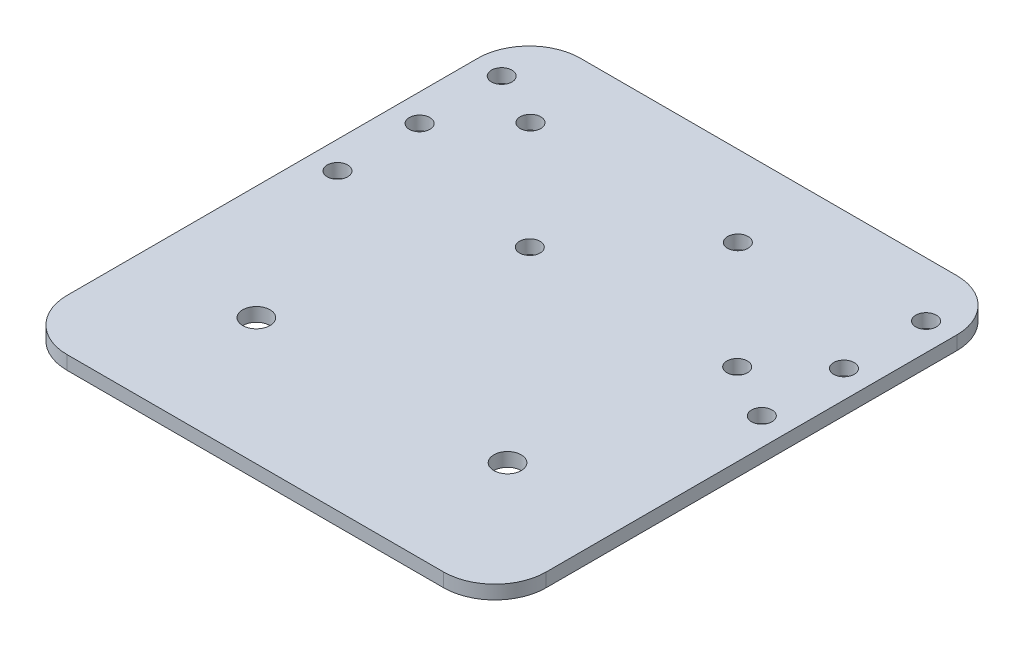
from build123d import *

# Parameters (mm, degrees)
SKETCH1_W           = 70
SKETCH1_H           = 75
SKETCH1_R           = 1.5
SKETCH1_R_2         = 2
BOSS_EXTRUDE1_DEPTH = 2
FILLET2_R           = 7.5


with BuildPart() as part:
    # Sketch1 → Boss-Extrude1 (new body)
    with BuildSketch(Plane(origin=(0, 0, 0), x_dir=(1, 0, 0), z_dir=(0, 1, 0))):
        with Locations((0, -1)):
            Rectangle(SKETCH1_W, SKETCH1_H)
        with Locations(Location((7.3, 24.7, 0), (0, 0, 270))):
            Circle(SKETCH1_R, mode=Mode.SUBTRACT)
        with Locations(Location((23, 8.9, 0), (0, 0, 270))):
            Circle(SKETCH1_R, mode=Mode.SUBTRACT)
        with Locations(Location((-23, 24.7, 0), (0, 0, 270))):
            Circle(SKETCH1_R, mode=Mode.SUBTRACT)
        with Locations(Location((-7.3, 8.9, 0), (0, 0, 270))):
            Circle(SKETCH1_R, mode=Mode.SUBTRACT)
        with Locations(Location((31, 16.5, 0), (0, 0, 270))):
            Circle(SKETCH1_R, mode=Mode.SUBTRACT)
        with Locations(Location((31, 28.5, 0), (0, 0, 270))):
            Circle(SKETCH1_R, mode=Mode.SUBTRACT)
        with Locations(Location((31, 4.5, 0), (0, 0, 270))):
            Circle(SKETCH1_R, mode=Mode.SUBTRACT)
        with Locations(Location((-31, 28.5, 0), (0, 0, 90))):
            Circle(SKETCH1_R, mode=Mode.SUBTRACT)
        with Locations(Location((-31, 16.5, 0), (0, 0, 90))):
            Circle(SKETCH1_R, mode=Mode.SUBTRACT)
        with Locations(Location((-31, 4.5, 0), (0, 0, 90))):
            Circle(SKETCH1_R, mode=Mode.SUBTRACT)
        with Locations(Location((18.35, -20, 0), (0, 0, 270))):
            Circle(SKETCH1_R_2, mode=Mode.SUBTRACT)
        with Locations(Location((-18.35, -20, 0), (0, 0, 90))):
            Circle(SKETCH1_R_2, mode=Mode.SUBTRACT)
    extrude(amount=BOSS_EXTRUDE1_DEPTH)

    # Fillet2
    fillet2_edges = [part.edges().sort_by_distance(p)[0] for p in [
        (-35, 1, -36.5),
        (35, 1, -36.5),
        (35, 1, 38.5),
        (-35, 1, 38.5),
    ]]
    fillet(fillet2_edges, radius=FILLET2_R)


solid = part.part
